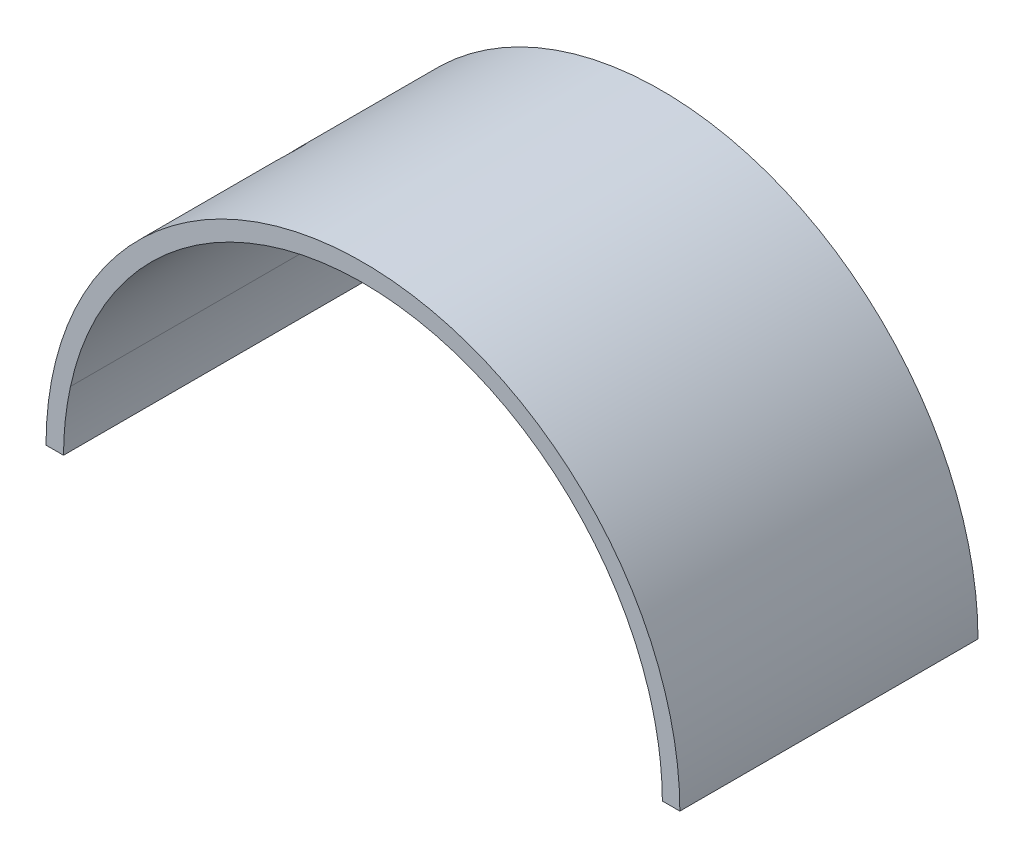
from build123d import *

# Parameters (mm, degrees)
BOSS_EXTRUDE1_DEPTH      = 15
BOSS_EXTRUDE2_DEPTH      = 15
F_3_0_3_DIAMETER_HOLE1_D = 3


with BuildPart() as part:
    # Sketch1 → Boss-Extrude1 (new, symmetric)
    with BuildSketch(Plane.XY):
        with BuildLine():
            Line((-31.891178344, 0), (-30.472178344, 0))
            ThreePointArc((-30.472178344, 0), (0, 30.472178344), (30.472178344, 0))
            Line((30.472178344, 0), (31.891178344, 0))
            ThreePointArc((31.891178344, 0), (0, 31.891178344), (-31.891178344, 0))
        make_face()
    extrude(amount=BOSS_EXTRUDE1_DEPTH, both=True)

    # Sketch2 → Boss-Extrude2 (add, symmetric)
    with BuildSketch(Plane.XY):
        with BuildLine():
            Line((-30.129278344, 0), (-30.472178344, 0))
            ThreePointArc((-30.472178344, 0), (0, 30.472178344), (30.472178344, 0))
            Line((30.472178344, 0), (30.129278344, 0))
            ThreePointArc((30.129278344, 0), (29.947091618, 3.193657531), (29.427339134, 6.35))
            add(Edge.make_bspline(
                [(29.427339134, 6.35), (24.299524612, 30.091178344), (0, 30.091178344), (-24.299524612, 30.091178344), (-29.427339134, 6.35)],
                knots=[0.212623764, 0.212623764, 0.212623764, 1.570796327, 1.570796327, 2.928968889, 2.928968889, 2.928968889], degree=2, weights=[1, 0.778146934, 1, 0.778146934, 1]))
            ThreePointArc((-29.427339134, 6.35), (-29.947091618, 3.193657531), (-30.129278344, 0))
        make_face()
    extrude(amount=BOSS_EXTRUDE2_DEPTH, both=True)

    # Ø3.0 (3) Diameter Hole1 (through all)
    with Locations(Plane(origin=(-22.550468467, 22.550468467, 0), x_dir=(0.707106781187, 0.707106781187, 0), z_dir=(-0.707106781187, 0.707106781187, 0))):
        with Locations((0, 0)):
            Hole(F_3_0_3_DIAMETER_HOLE1_D / 2)


solid = part.part
